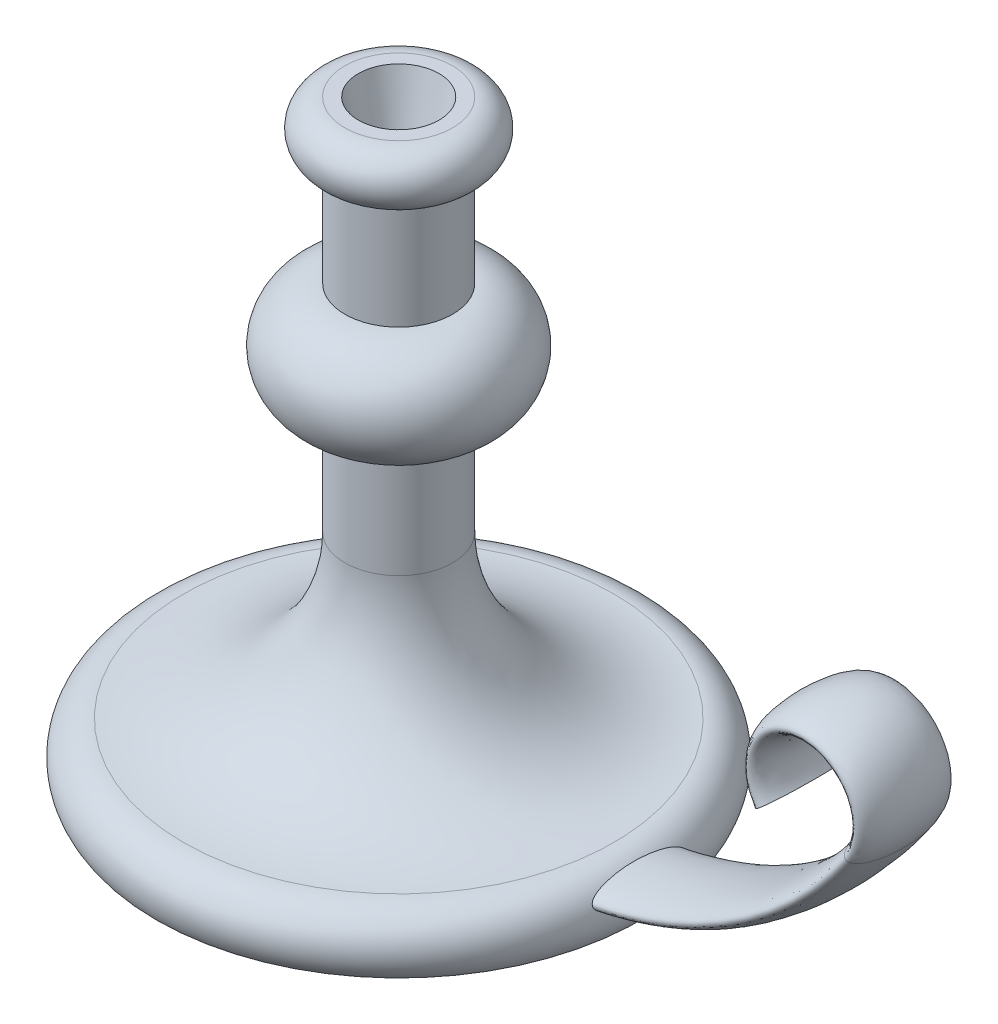
from build123d import *

# Parameters (mm, degrees)
SKETCH_3_RX         = 17.5
SKETCH_3_RY         = 5
SKETCH_5_R          = 15
CUT_EXTRUDE_1_DEPTH = 25
CUT_EXTRUDE_1_DRAFT = -15


with BuildPart() as part:
    # Эскиз1 → Повернуть1 (revolve)
    with BuildSketch(Plane.XY, mode=Mode.PRIVATE) as revolve_1_sk:
        with BuildLine():
            Line((0, 0), (0, 220))
            Line((0, 220), (20, 220))
            ThreePointArc((20, 220), (30, 210), (20, 200))
            Line((20, 200), (20, 160))
            ThreePointArc((20, 160), (40, 140), (20, 120))
            Line((20, 120), (20, 80))
            ThreePointArc((20, 80), (37.573593129, 37.573593129), (80, 20))
            ThreePointArc((80, 20), (91.180339887, 13.090169944), (90, 0))
            Line((90, 0), (0, 0))
        make_face()
    revolve(revolve_1_sk.sketch.rotate(Axis((0, 0, 0), (0, 1, 0)), 90), axis=Axis((0, 0, 0), (0, 1, 0)))

    # По траектории1: sweep along a path in Эскиз2
    with BuildLine(Plane.XY) as sweep_1_path:
        Line((0, 10), (60, 10))
        ThreePointArc((60, 10), (129.821200219, 27.240819526), (183.592070943, 75))
        ThreePointArc((183.592070943, 75), (167.113128151, 106.333333333), (150.634185358, 75))
    # Эскиз3 → По траектории1 (sweep)
    with BuildSketch(Plane(origin=(0, 0, 0), x_dir=(0, 0, -1), z_dir=(1, 0, 0))):
        with Locations(Location((0, 10), (0, 0, 180))):
            Ellipse(SKETCH_3_RX, SKETCH_3_RY)
    sweep(path=sweep_1_path.line)


with BuildPart() as cut_extrude_1_tool:
    # Эскиз5 → Вырез-Вытянуть1 (with draft: the straight prism first)
    with BuildSketch(Plane(origin=(0, 220, 0), x_dir=(1, 0, 0), z_dir=(0, 1, 0))):
        Circle(SKETCH_5_R)
    extrude(amount=-CUT_EXTRUDE_1_DEPTH)
    # Вырез-Вытянуть1: the draft: its side faces are tilted about the plane it starts from
    cut_extrude_1_sides = [cut_extrude_1_tool.faces().sort_by_distance(p)[0] for p in [
        (-15, 207.5, 0),
    ]]
    draft(cut_extrude_1_sides, Plane(origin=(0, 220, 0), x_dir=(1, 0, 0), z_dir=(0, 1, 0)), CUT_EXTRUDE_1_DRAFT)


with BuildPart() as part_1:
    add(part.part)

    # Вырез-Вытянуть1: cut by cut_extrude_1_tool
    add(cut_extrude_1_tool.part, mode=Mode.SUBTRACT)


solid = part_1.part
